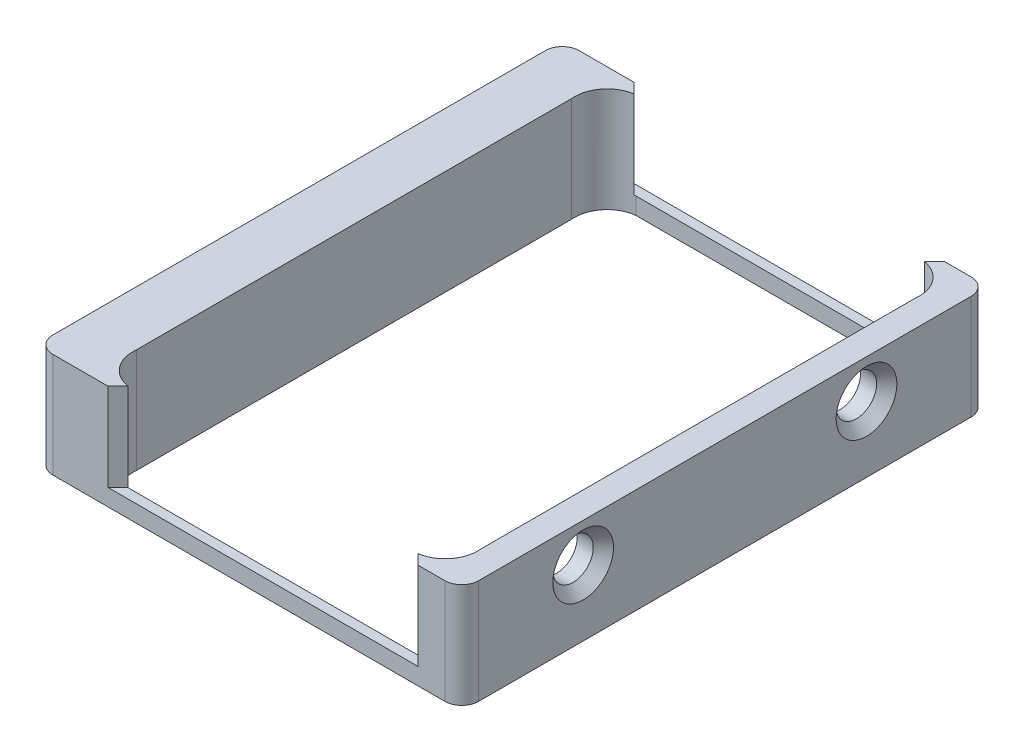
from build123d import *

# Parameters (mm, degrees)
SKETCH_1_W          = 126.2
SKETCH_1_H          = 156
EXTRUDE_1_DEPTH     = 31
CUT_EXTRUDE_START   = -26
CUT_EXTRUDE_1_DEPTH = 26
FILLET_1_R          = 5
F_12_0MM_1_D        = 12
F_12_0MM_1_DEPTH    = 17
F_12_0MM_1_TIP      = 3.605163714
SKETCH_6_R          = 2.1
CUT_EXTRUDE_2_DEPTH = 10
SKETCH_7_R          = 2.1
CUT_EXTRUDE_3_DEPTH = 10
CHAMFER_1_SIZE      = 3


with BuildPart() as part:
    # 草图1 → 凸台-拉伸1 (new body)
    with BuildSketch(Plane(origin=(0, 0, 0), x_dir=(1, 0, 0), z_dir=(0, 1, 0))):
        with Locations((-4.2, 0)):
            Rectangle(SKETCH_1_W, SKETCH_1_H)
        with BuildLine():
            Line((-42.5, 75.1), (42.5, 75.1))
            ThreePointArc((42.5, 75.1), (48.995331881, 71.581118318), (51.1, 64.5))
            Line((51.1, 64.5), (51.1, -64.5))
            ThreePointArc((51.1, -64.5), (48.995331881, -71.581118318), (42.5, -75.1))
            Line((42.5, -75.1), (-42.5, -75.1))
            ThreePointArc((-42.5, -75.1), (-48.995331881, -71.581118318), (-51.1, -64.5))
            Line((-51.1, -64.5), (-51.1, 64.5))
            ThreePointArc((-51.1, 64.5), (-48.995331881, 71.581118318), (-42.5, 75.1))
        make_face(mode=Mode.SUBTRACT)
    extrude(amount=EXTRUDE_1_DEPTH)

    # 草图2 → 切除-拉伸1 (cut)
    with BuildSketch(Plane(origin=(0, 31, 0), x_dir=(1, 0, 0), z_dir=(0, 1, 0)).offset(CUT_EXTRUDE_START)):
        with BuildLine():
            Line((-42.780928277, -74.780928277), (-43.029918625, -75.029918625))
            ThreePointArc((-43.029918625, -75.029918625), (-42.765444551, -75.068628433), (-42.5, -75.1))
            Line((-42.5, -75.1), (-42.780928277, -74.780928277))
        make_face()
        with BuildLine():
            Line((-43.029918625, -75.029918625), (-43.1, -75.1))
            Line((-43.1, -75.1), (-42.5, -75.1))
            ThreePointArc((-42.5, -75.1), (-42.765444551, -75.068628433), (-43.029918625, -75.029918625))
        make_face()
        Polygon((43.1, -75.1), (42.5, -75.1), (-42.5, -75.1), (-43.1, -75.1), (-46, -78), (46, -78), align=None)
        with BuildLine():
            ThreePointArc((42.5, -75.1), (42.765444551, -75.068628433), (43.029918625, -75.029918625))
            Line((43.029918625, -75.029918625), (42.872377268, -74.872377268))
            Line((42.872377268, -74.872377268), (42.5, -75.1))
        make_face()
        with BuildLine():
            Line((42.5, -75.1), (43.1, -75.1))
            Line((43.1, -75.1), (43.029918625, -75.029918625))
            ThreePointArc((43.029918625, -75.029918625), (42.765444551, -75.068628433), (42.5, -75.1))
        make_face()
        Polygon((46, 78), (-46, 78), (-43.1, 75.1), (-42.5, 75.1), (42.5, 75.1), (43.1, 75.1), align=None)
        with BuildLine():
            Line((-42.780928277, 74.780928277), (-42.5, 75.1))
            ThreePointArc((-42.5, 75.1), (-42.765444551, 75.068628433), (-43.029918625, 75.029918625))
            Line((-43.029918625, 75.029918625), (-42.780928277, 74.780928277))
        make_face()
        with BuildLine():
            Line((-42.5, 75.1), (-43.1, 75.1))
            Line((-43.1, 75.1), (-43.029918625, 75.029918625))
            ThreePointArc((-43.029918625, 75.029918625), (-42.765444551, 75.068628433), (-42.5, 75.1))
        make_face()
        with BuildLine():
            ThreePointArc((43.029918625, 75.029918625), (42.765444551, 75.068628433), (42.5, 75.1))
            Line((42.5, 75.1), (42.872377268, 74.872377268))
            Line((42.872377268, 74.872377268), (43.029918625, 75.029918625))
        make_face()
        with BuildLine():
            Line((43.029918625, 75.029918625), (43.1, 75.1))
            Line((43.1, 75.1), (42.5, 75.1))
            ThreePointArc((42.5, 75.1), (42.765444551, 75.068628433), (43.029918625, 75.029918625))
        make_face()
    extrude(amount=CUT_EXTRUDE_1_DEPTH, mode=Mode.SUBTRACT)

    # 圆角1
    fillet_1_edges = [part.edges().sort_by_distance(p)[0] for p in [
        (58.9, 15.5, -78),
        (58.9, 15.5, 78),
        (-67.3, 15.5, 78),
        (-67.3, 15.5, -78),
    ]]
    fillet(fillet_1_edges, radius=FILLET_1_R)

    # Ø12.0mm 暗销孔1
    with Locations(Plane(origin=(58.9, 0, 0), x_dir=(0, 0, -1), z_dir=(1, 0, 0))):
        with Locations((42, 19.55), (-42, 19.55)):
            Hole(F_12_0MM_1_D / 2, depth=F_12_0MM_1_DEPTH)
            with Locations((0, 0, -(F_12_0MM_1_DEPTH + F_12_0MM_1_TIP / 2))):  # 118° drill point
                Cone(0, F_12_0MM_1_D / 2, F_12_0MM_1_TIP, mode=Mode.SUBTRACT)

    # 草图6 → 切除-拉伸2 (cut)
    with BuildSketch(Plane.ZY.offset(67.3)):
        with Locations((-11, 13.95)):
            Circle(SKETCH_6_R)
        with Locations(Location((11, 13.95, 0), (0, 0, 180))):
            Circle(SKETCH_6_R)
    extrude(amount=-CUT_EXTRUDE_2_DEPTH, mode=Mode.SUBTRACT)

    # 草图7 → 切除-拉伸3 (cut)
    with BuildSketch(Plane.XZ):
        with Locations(Location((-58.493442579, 70.964337058, 0), (0, 0, 270))):
            Circle(SKETCH_7_R)
        with Locations(Location((53.705008218, 73.348219362, 0), (0, 0, 270))):
            Circle(SKETCH_7_R)
        with Locations(Location((-58.493442579, -70.964337058, 0), (0, 0, 270))):
            Circle(SKETCH_7_R)
        with Locations(Location((53.705008218, -73.348219362, 0), (0, 0, 270))):
            Circle(SKETCH_7_R)
    extrude(amount=-CUT_EXTRUDE_3_DEPTH, mode=Mode.SUBTRACT)

    # 倒角1
    chamfer_1_edges = [part.edges().sort_by_distance(p)[0] for p in [
        (58.9, 19.55, 36),
        (58.9, 19.55, -48),
    ]]
    chamfer(chamfer_1_edges, length=CHAMFER_1_SIZE)


solid = part.part
